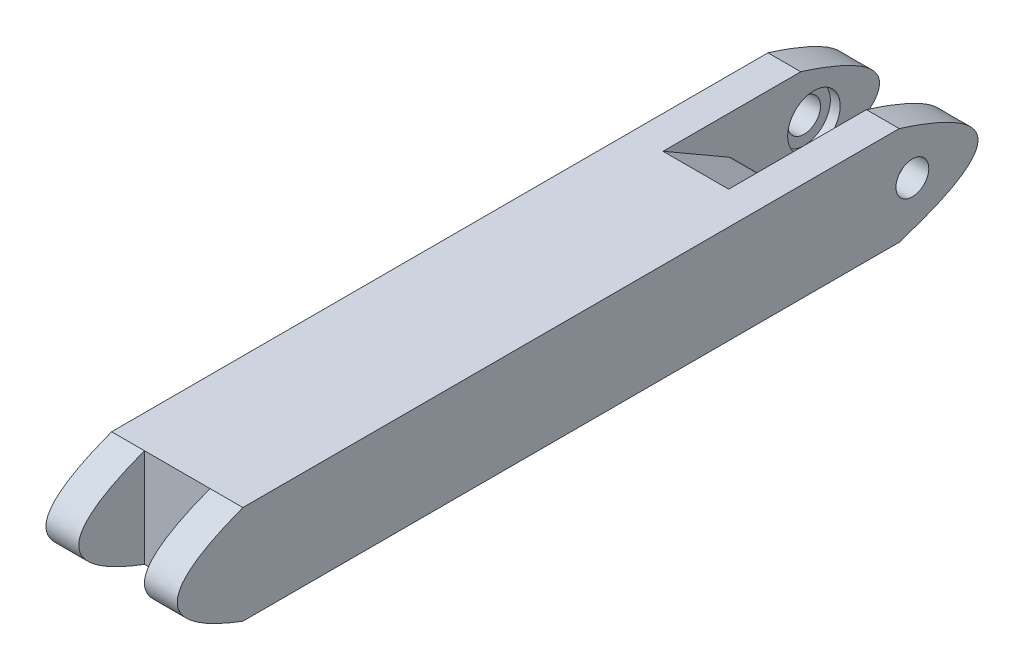
from build123d import *

# Parameters (mm, degrees)
SKETCH1_R               = 4
BOSS_EXTRUDE1_DEPTH     = 20
CUT_EXTRUDE1_DEPTH      = 52
CUT_EXTRUDE1_DEPTH_BACK = 35
SKETCH2_W               = 10
SKETCH2_H               = 20
SKETCH3_W               = 10
SKETCH3_H               = 10
CUT_EXTRUDE2_DEPTH      = 52
CUT_EXTRUDE3_START      = -5
CUT_EXTRUDE3_DEPTH      = 10
CUT_EXTRUDE4_START      = -5
CUT_EXTRUDE4_DEPTH      = 10
FILLET1_R               = 2
SKETCH9_R               = 4
SKETCH9_R_2             = 2.5
BOSS_EXTRUDE2_DEPTH     = 3.5
BOSS_EXTRUDE3_START     = -3.5
SKETCH10_R              = 4
SKETCH10_R_2            = 2.5
BOSS_EXTRUDE3_DEPTH     = 3.5


with BuildPart() as part:
    # Sketch1 → Boss-Extrude1 (new body)
    with BuildSketch(Plane(origin=(0, 0, 0), x_dir=(0, 0, -1), z_dir=(1, 0, 0))):
        with BuildLine():
            Line((-41.59166249, 42.046001407), (58.40833751, 42.046001407))
            add(Edge.make_bspline(
                [(58.40833751, 42.046001407), (82.40833751, 34.546001407), (58.40833751, 27.046001407)],
                knots=[0, 0, 0, 1, 1, 1], degree=2))
            Line((58.40833751, 27.046001407), (-41.59166249, 27.046001407))
            add(Edge.make_bspline(
                [(-41.59166249, 42.046001407), (-61.59166249, 34.546001407), (-41.59166249, 27.046001407)],
                knots=[0, 0, 0, 1, 1, 1], degree=2))
        make_face()
        with Locations((60.40833751, 34.546001407)):
            Circle(SKETCH1_R, mode=Mode.SUBTRACT)
    extrude(amount=BOSS_EXTRUDE1_DEPTH)

    # Sketch2 → Cut-Extrude1 (cut, two sides: drawn at the far end of the back side and taken through both)
    with BuildSketch(Plane(origin=(0, 0, 0), x_dir=(1, 0, 0), z_dir=(0, 1, 0)).offset(-CUT_EXTRUDE1_DEPTH_BACK)):
        with Locations((10, 60.40833751)):
            Rectangle(SKETCH2_W, SKETCH2_H)
    extrude(amount=CUT_EXTRUDE1_DEPTH + CUT_EXTRUDE1_DEPTH_BACK, mode=Mode.SUBTRACT)

    # Sketch3 → Cut-Extrude2 (cut)
    with BuildSketch(Plane.XZ.offset(-27.046001407)):
        with Locations((10, 46.59166249)):
            Rectangle(SKETCH3_W, SKETCH3_H)
    extrude(amount=-CUT_EXTRUDE2_DEPTH, mode=Mode.SUBTRACT)

    # Sketch4 → Cut-Extrude3 (cut)
    with BuildSketch(Plane.ZY.offset(CUT_EXTRUDE3_START)):
        Polygon((-50.40833751, 34.546001407), (-50.40833751, 42.046001407), (-37.417956453, 42.046001407), align=None)
    extrude(amount=-CUT_EXTRUDE3_DEPTH, mode=Mode.SUBTRACT)

    # Sketch5 → Cut-Extrude4 (cut)
    with BuildSketch(Plane.ZY.offset(CUT_EXTRUDE4_START)):
        Polygon((-50.40833751, 27.046001407), (-50.40833751, 34.546001407), (-37.417956453, 27.046001407), align=None)
    extrude(amount=-CUT_EXTRUDE4_DEPTH, mode=Mode.SUBTRACT)

    # Fillet1
    fillet1_edges = [part.edges().sort_by_distance(p)[0] for p in [
        (10, 34.546001407, -50.40833751),
    ]]
    fillet(fillet1_edges, radius=FILLET1_R)

    # Sketch9 → Boss-Extrude2 (add)
    with BuildSketch(Plane.ZY):
        with Locations((-60.40833751, 34.546001407)):
            Circle(SKETCH9_R)
        with Locations((-60.40833751, 34.546001407)):
            Circle(SKETCH9_R_2, mode=Mode.SUBTRACT)
    extrude(amount=-BOSS_EXTRUDE2_DEPTH)

    # Sketch10 → Boss-Extrude3 (add)
    with BuildSketch(Plane(origin=(20, 0, 0), x_dir=(0, 0, -1), z_dir=(1, 0, 0)).offset(BOSS_EXTRUDE3_START)):
        with Locations((60.40833751, 34.546001407)):
            Circle(SKETCH10_R)
        with Locations(Location((60.40833751, 34.546001407, 0), (0, 0, 180))):
            Circle(SKETCH10_R_2, mode=Mode.SUBTRACT)
    extrude(amount=BOSS_EXTRUDE3_DEPTH)


solid = part.part
